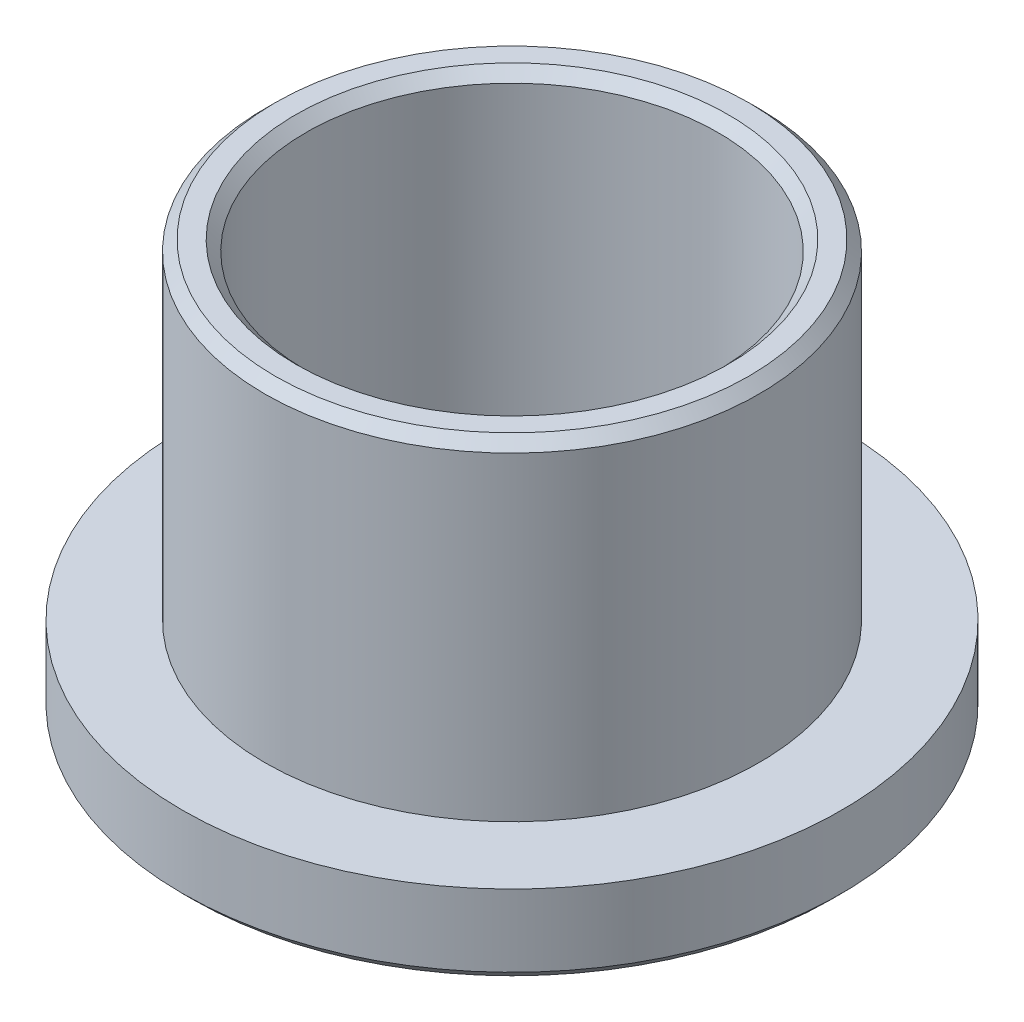
from build123d import *

# Parameters (mm, degrees)
SKETCH_1_R      = 8
SKETCH_1_R_2    = 5
EXTRUDE_1_DEPTH = 2
SKETCH_2_R      = 6
SKETCH_2_R_2    = 5
EXTRUDE_2_DEPTH = 8
CHAMFER_1_SIZE  = 0.25


with BuildPart() as part:
    # 草图1 → 凸台-拉伸1 (new body)
    with BuildSketch(Plane(origin=(0, 0, 0), x_dir=(1, 0, 0), z_dir=(0, 1, 0))):
        with Locations(Location((0, 0, 0), (0, 0, 270))):
            Circle(SKETCH_1_R)
        with Locations(Location((0, 0, 0), (0, 0, 270))):
            Circle(SKETCH_1_R_2, mode=Mode.SUBTRACT)
    extrude(amount=EXTRUDE_1_DEPTH)

    # 草图2 → 凸台-拉伸2 (add)
    with BuildSketch(Plane(origin=(0, 2, 0), x_dir=(1, 0, 0), z_dir=(0, 1, 0))):
        with Locations(Location((0, 0, 0), (0, 0, 270))):
            Circle(SKETCH_2_R)
        with Locations(Location((0, 0, 0), (0, 0, 270))):
            Circle(SKETCH_2_R_2, mode=Mode.SUBTRACT)
    extrude(amount=EXTRUDE_2_DEPTH)

    # 倒角1
    chamfer_1_edges = [part.edges().sort_by_distance(p)[0] for p in [
        (0, 10, -6),
        (0, 10, -5),
        (0, 0, -8),
        (0, 0, -5),
    ]]
    chamfer(chamfer_1_edges, length=CHAMFER_1_SIZE)


solid = part.part
